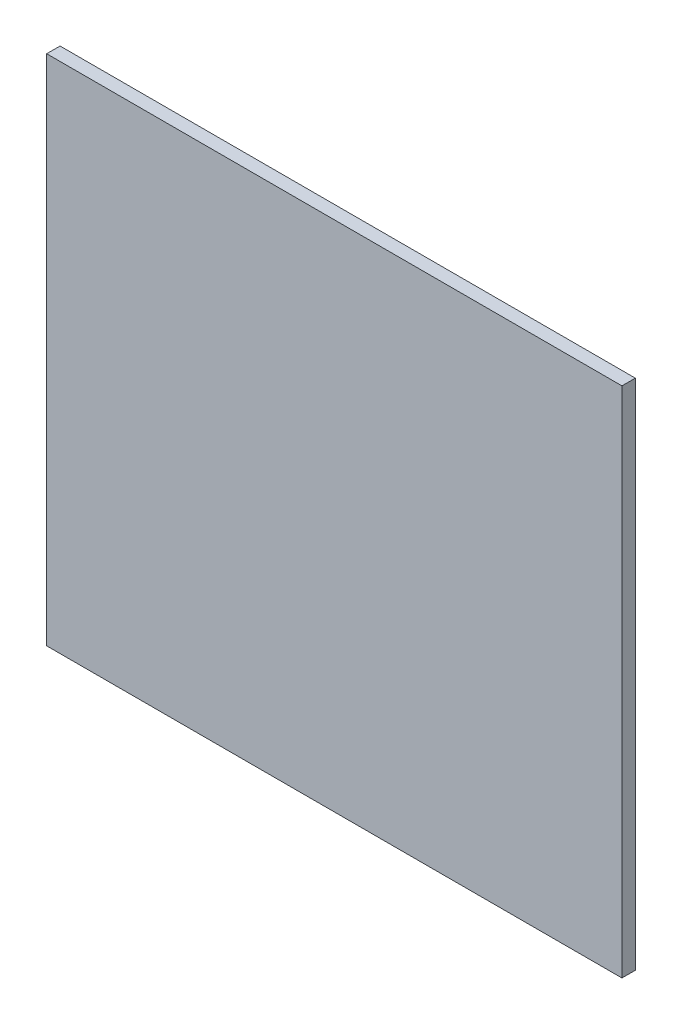
from build123d import *

# Parameters (mm, degrees)
ESBO_O1_W                = 258
ESBO_O1_H                = 230
RESSALTO_EXTRUS_O1_DEPTH = 6


with BuildPart() as part:
    # Esboço1 → Ressalto-extrusão1 (new body)
    with BuildSketch(Plane.XY):
        with Locations((-129, 115)):
            Rectangle(ESBO_O1_W, ESBO_O1_H)
    extrude(amount=RESSALTO_EXTRUS_O1_DEPTH)


solid = part.part
